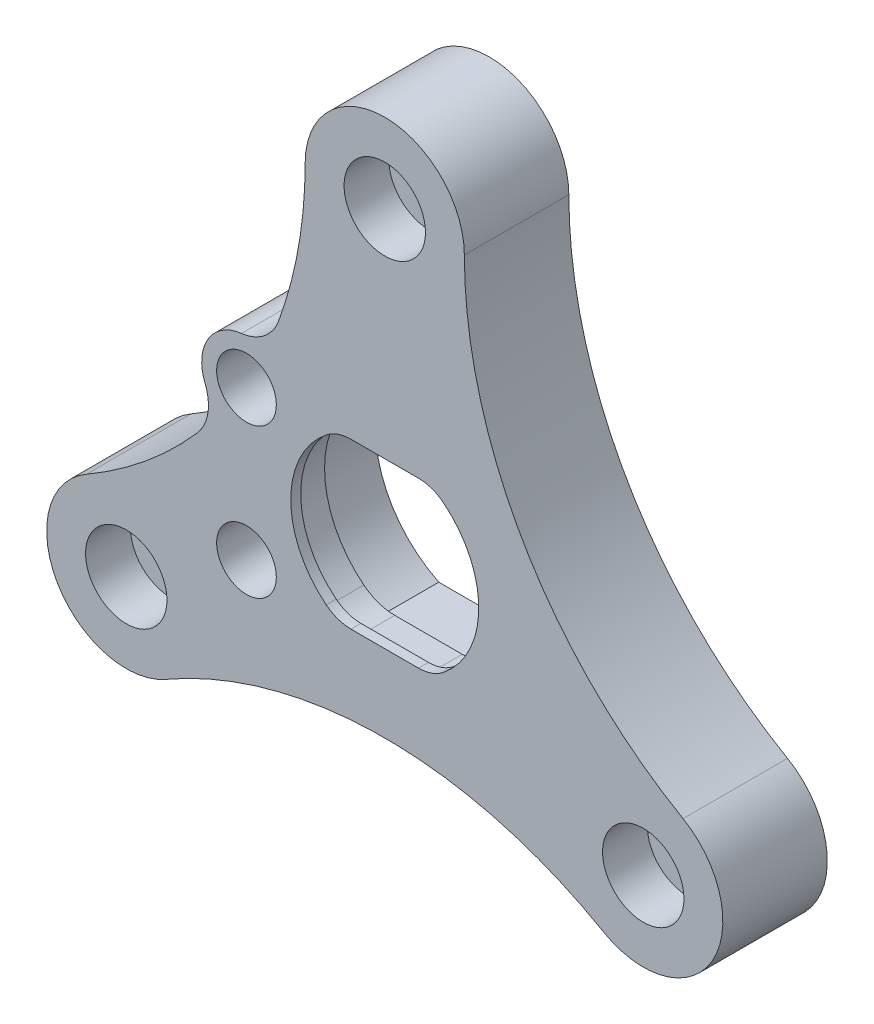
from build123d import *

# Parameters (mm, degrees)
SKETCH1_R           = 4.09
BOSS_EXTRUDE1_DEPTH = 4.5
BOSS_EXTRUDE2_START = -6
SKETCH1_3_R         = 4.09
SKETCH1_3_R_2       = 2
BOSS_EXTRUDE2_DEPTH = 6
SKETCH2_W           = 20.9
SKETCH2_H           = 18.53
BOSS_EXTRUDE3_DEPTH = 1
FILLET1_R           = 5
FILLET2_R           = 4
SKETCH3_3_R         = 4.5
BOSS_EXTRUDE4_DEPTH = 10.5
SKETCH3_R           = 1.75
CUT_EXTRUDE1_DEPTH  = 53.0474994
FILLET3_R           = 4.5
CUT_EXTRUDE2_DEPTH  = 6.1
SKETCH5_R           = 3
CUT_EXTRUDE3_DEPTH  = 4.5
FILLET4_R           = 1


with BuildPart() as part:
    # Sketch1 → Boss-Extrude1 (new body)
    with BuildSketch(Plane.XY):
        with BuildLine():
            ThreePointArc((-21.980762114, -21.92820323), (-32.908965344, -19), (-29.980762114, -8.07179677))
            ThreePointArc((-29.980762114, -8.07179677), (-13.889727457, 8.019237886), (-8, 30))
            ThreePointArc((-8, 30), (0, 38), (8, 30))
            ThreePointArc((8, 30), (13.889727457, 8.019237886), (29.980762114, -8.07179677))
            ThreePointArc((29.980762114, -8.07179677), (32.908965344, -19), (21.980762114, -21.92820323))
            ThreePointArc((21.980762114, -21.92820323), (0, -16.038475773), (-21.980762114, -21.92820323))
        make_face()
        with Locations((0, 30)):
            Circle(SKETCH1_R, mode=Mode.SUBTRACT)
        with Locations((25.980762114, -15)):
            Circle(SKETCH1_R, mode=Mode.SUBTRACT)
        with Locations((-25.980762114, -15)):
            Circle(SKETCH1_R, mode=Mode.SUBTRACT)
        with BuildLine():
            Line((4.833453734, 9.265), (-4.833453734, 9.265))
            ThreePointArc((-4.833453734, 9.265), (-10.45, 0), (-4.833453734, -9.265))
            Line((-4.833453734, -9.265), (4.833453734, -9.265))
            ThreePointArc((4.833453734, -9.265), (10.45, 0), (4.833453734, 9.265))
        make_face(mode=Mode.SUBTRACT)
    extrude(amount=BOSS_EXTRUDE1_DEPTH)

    # Sketch1<3> → Boss-Extrude2 (add)
    # profile 1 of 4: a face of its own
    with BuildSketch(Plane.XY.offset(BOSS_EXTRUDE2_START)):
        with BuildLine():
            ThreePointArc((-29.980762114, -8.07179677), (-32.908965344, -19), (-21.980762114, -21.92820323))
            ThreePointArc((-21.980762114, -21.92820323), (0, -16.038475773), (21.980762114, -21.92820323))
            ThreePointArc((21.980762114, -21.92820323), (32.908965344, -19), (29.980762114, -8.07179677))
            ThreePointArc((29.980762114, -8.07179677), (13.889727457, 8.019237886), (8, 30))
            ThreePointArc((8, 30), (0, 38), (-8, 30))
            ThreePointArc((-8, 30), (-13.889727457, 8.019237886), (-29.980762114, -8.07179677))
        make_face()
        with Locations((-25.980762114, -15)):
            Circle(SKETCH1_3_R, mode=Mode.SUBTRACT)
        with BuildLine():
            Line((-4.833453734, 9.265), (4.833453734, 9.265))
            ThreePointArc((4.833453734, 9.265), (10.45, 0), (4.833453734, -9.265))
            Line((4.833453734, -9.265), (-4.833453734, -9.265))
            ThreePointArc((-4.833453734, -9.265), (-10.45, 0), (-4.833453734, 9.265))
        make_face(mode=Mode.SUBTRACT)
        with Locations((25.980762114, -15)):
            Circle(SKETCH1_3_R, mode=Mode.SUBTRACT)
        with Locations((0, 30)):
            Circle(SKETCH1_3_R, mode=Mode.SUBTRACT)
    # profile 2 of 4: a face of its own
    with BuildSketch(Plane.XY.offset(BOSS_EXTRUDE2_START)):
        with Locations((0, 30)):
            Circle(SKETCH1_3_R)
        with Locations((0, 30)):
            Circle(SKETCH1_3_R_2, mode=Mode.SUBTRACT)
    # profile 3 of 4: a face of its own
    with BuildSketch(Plane.XY.offset(BOSS_EXTRUDE2_START)):
        with Locations((25.980762114, -15)):
            Circle(SKETCH1_3_R)
        with Locations((25.980762114, -15)):
            Circle(SKETCH1_3_R_2, mode=Mode.SUBTRACT)
    # profile 4 of 4: a face of its own
    with BuildSketch(Plane.XY.offset(BOSS_EXTRUDE2_START)):
        with Locations((-25.980762114, -15)):
            Circle(SKETCH1_3_R)
        with Locations((-25.980762114, -15)):
            Circle(SKETCH1_3_R_2, mode=Mode.SUBTRACT)
    extrude(amount=BOSS_EXTRUDE2_DEPTH)

    # Sketch2 → Boss-Extrude3 (add)
    with BuildSketch(Plane.XY.offset(4.5)):
        Rectangle(SKETCH2_W, SKETCH2_H)
        with BuildLine():
            Line((-4.581732751, 8.265), (4.581732751, 8.265))
            ThreePointArc((4.581732751, 8.265), (9.45, 0), (4.581732751, -8.265))
            Line((4.581732751, -8.265), (-4.581732751, -8.265))
            ThreePointArc((-4.581732751, -8.265), (-9.45, 0), (-4.581732751, 8.265))
        make_face(mode=Mode.SUBTRACT)
    extrude(amount=-BOSS_EXTRUDE3_DEPTH)

    # Fillet1
    fillet1_edges = [part.edges().sort_by_distance(p)[0] for p in [
        (4.833453734, -9.265, -1.25),
        (-4.833453734, -9.265, -1.25),
        (4.833453734, 9.265, -1.25),
        (-4.833453734, 9.265, -1.25),
    ]]
    fillet(fillet1_edges, radius=FILLET1_R)

    # Fillet2
    fillet2_edges = [part.edges().sort_by_distance(p)[0] for p in [
        (-4.581732751, 8.265, 4),
        (4.581732751, 8.265, 4),
        (4.581732751, -8.265, 4),
        (-4.581732751, -8.265, 4),
    ]]
    fillet(fillet2_edges, radius=FILLET2_R)

    # Sketch3<3> → Boss-Extrude4 (add)
    with BuildSketch(Plane(origin=(0, 0, -6), x_dir=(-1, 0, 0), z_dir=(0, 0, -1))):
        with Locations((13.9, 7.5)):
            Circle(SKETCH3_3_R)
    extrude(amount=-BOSS_EXTRUDE4_DEPTH)

    # Sketch3 → Cut-Extrude1 (cut, through all)
    with BuildSketch(Plane(origin=(0, 0, -6), x_dir=(-1, 0, 0), z_dir=(0, 0, -1))):
        with Locations((13.9, 7.5)):
            Circle(SKETCH3_R)
        with Locations((13.9, -7.5)):
            Circle(SKETCH3_R)
    extrude(amount=-CUT_EXTRUDE1_DEPTH, mode=Mode.SUBTRACT)

    # Fillet3
    fillet3_edges = [part.edges().sort_by_distance(p)[0] for p in [
        (-16.59118096, 3.893402567, -0.75),
        (-12.037519589, 11.596482237, -0.75),
    ]]
    fillet(fillet3_edges, radius=FILLET3_R)

    # Sketch4 → Cut-Extrude2 (cut)
    with BuildSketch(Plane(origin=(0, 0, -6), x_dir=(-1, 0, 0), z_dir=(0, 0, -1))):
        with BuildLine():
            Line((-5.072698986, 10.265), (5.072698986, 10.265))
            ThreePointArc((5.072698986, 10.265), (11.45, 0), (5.072698986, -10.265))
            Line((5.072698986, -10.265), (-5.072698986, -10.265))
            ThreePointArc((-5.072698986, -10.265), (-11.45, 0), (-5.072698986, 10.265))
        make_face()
        with BuildLine():
            Line((8.083004052, 13.265), (-8.083004052, 13.265))
            ThreePointArc((-8.083004052, 13.265), (-5.777181935, 21.491693192), (-5, 30))
            ThreePointArc((-5, 30), (0, 25), (5, 30))
            ThreePointArc((5, 30), (5.777181935, 21.491693192), (8.083004052, 13.265))
        make_face()
        with BuildLine():
            ThreePointArc((-28.480762114, -10.669872981), (-21.650635095, -12.5), (-23.480762114, -19.330127019))
            ThreePointArc((-23.480762114, -19.330127019), (-14.795111216, -15.429949048), (-5.501310095, -13.361814519))
            ThreePointArc((-5.501310095, -13.361814519), (-12.514067085, -7.225), (-14.322325862, 1.916632963))
            ThreePointArc((-14.322325862, 1.916632963), (-20.760283463, -5.097967641), (-28.480762114, -10.669872981))
        make_face()
        with BuildLine():
            ThreePointArc((28.480762114, -10.669872981), (21.650635095, -12.5), (23.480762114, -19.330127019))
            ThreePointArc((23.480762114, -19.330127019), (17.473625365, -16.410354735), (11.113030226, -14.372318523))
            ThreePointArc((11.113030226, -14.372318523), (17.489946086, -10.61043198), (18.888273505, -3.339838698))
            ThreePointArc((18.888273505, -3.339838698), (23.447993359, -7.314384829), (28.480762114, -10.669872981))
        make_face()
    extrude(amount=-CUT_EXTRUDE2_DEPTH, mode=Mode.SUBTRACT)

    # Sketch5 → Cut-Extrude3 (cut)
    with BuildSketch(Plane.XY.offset(4.5)):
        with Locations((-13.9, 7.5)):
            Circle(SKETCH5_R)
        with Locations((-13.9, -7.5)):
            Circle(SKETCH5_R)
    extrude(amount=-CUT_EXTRUDE3_DEPTH, mode=Mode.SUBTRACT)

    # Fillet4
    fillet4_edges = [part.edges().sort_by_distance(p)[0] for p in [
        (-11.113030226, -14.372318523, -2.95),
        (-18.888273505, -3.339838698, -2.95),
        (-28.480762114, -10.669872981, -2.95),
        (-23.480762114, -19.330127019, -2.95),
        (28.480762114, -10.669872981, -2.95),
        (14.322325862, 1.916632963, -2.95),
        (5.501310095, -13.361814519, -2.95),
        (23.480762114, -19.330127019, -2.95),
        (8.083004052, 13.265, -2.95),
        (5, 30, -2.95),
        (-5, 30, -2.95),
        (-8.083004052, 13.265, -2.95),
    ]]
    fillet(fillet4_edges, radius=FILLET4_R)


solid = part.part
